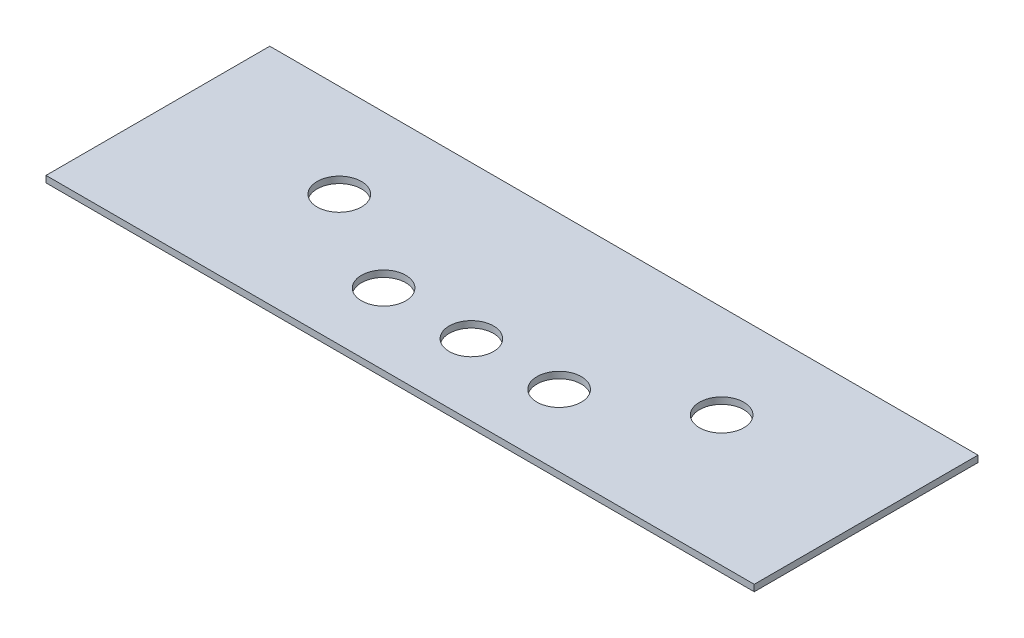
from build123d import *

# Parameters (mm, degrees)
SKETCH2_W           = 326
SKETCH2_H           = 103
BOSS_EXTRUDE1_DEPTH = 3
CUT_EXTRUDE1_START  = -3
SKETCH3_R           = 10.2
CUT_EXTRUDE1_DEPTH  = 3


with BuildPart() as part:
    # Sketch2 → Boss-Extrude1 (new body)
    with BuildSketch(Plane(origin=(0, 0, 0), x_dir=(1, 0, 0), z_dir=(0, 1, 0))):
        Rectangle(SKETCH2_W, SKETCH2_H)
    extrude(amount=BOSS_EXTRUDE1_DEPTH)

    # Sketch3 → Cut-Extrude1 (cut)
    with BuildSketch(Plane(origin=(0, 3, 0), x_dir=(1, 0, 0), z_dir=(0, 1, 0)).offset(CUT_EXTRUDE1_START)):
        with Locations(Location((-88, 8.5, 0), (0, 0, 270))):
            Circle(SKETCH3_R)
        with Locations(Location((88, 8.5, 0), (0, 0, 270))):
            Circle(SKETCH3_R)
        with Locations(Location((-40.4, -18.7, 0), (0, 0, 270))):
            Circle(SKETCH3_R)
        with Locations(Location((0, -18.7, 0), (0, 0, 270))):
            Circle(SKETCH3_R)
        with Locations(Location((40.4, -18.7, 0), (0, 0, 270))):
            Circle(SKETCH3_R)
    extrude(amount=CUT_EXTRUDE1_DEPTH, mode=Mode.SUBTRACT)


solid = part.part
